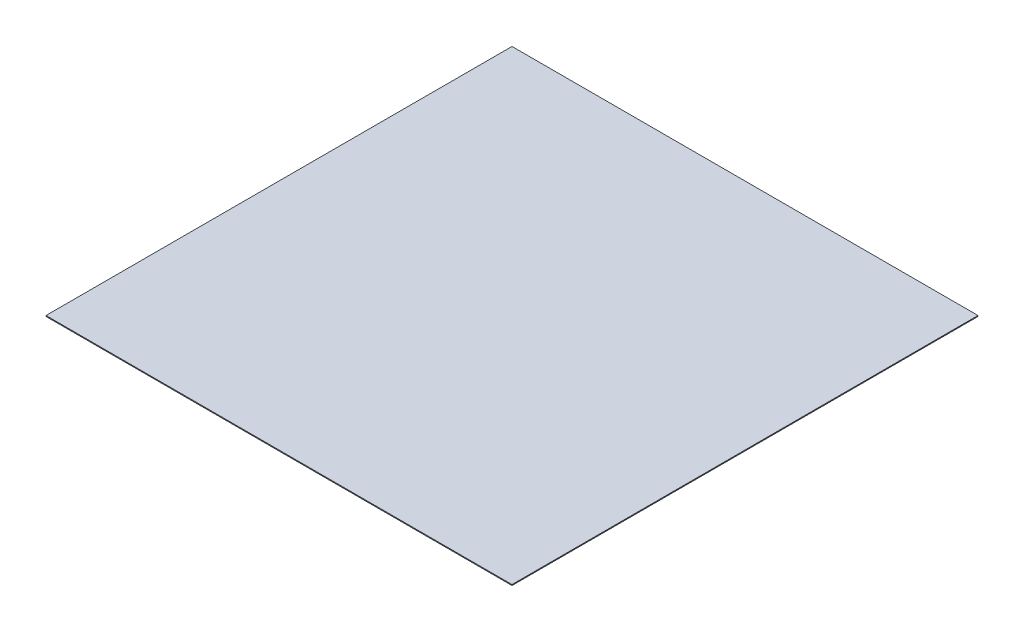
from build123d import *

# Parameters (mm, degrees)
SKETCH1_W           = 3350
SKETCH1_H           = 3350
BOSS_EXTRUDE1_DEPTH = 6.35


with BuildPart() as part:
    # Sketch1 → Boss-Extrude1 (new body)
    with BuildSketch(Plane(origin=(0, 0, 0), x_dir=(1, 0, 0), z_dir=(0, 1, 0))):
        Rectangle(SKETCH1_W, SKETCH1_H)
    extrude(amount=BOSS_EXTRUDE1_DEPTH)


solid = part.part
